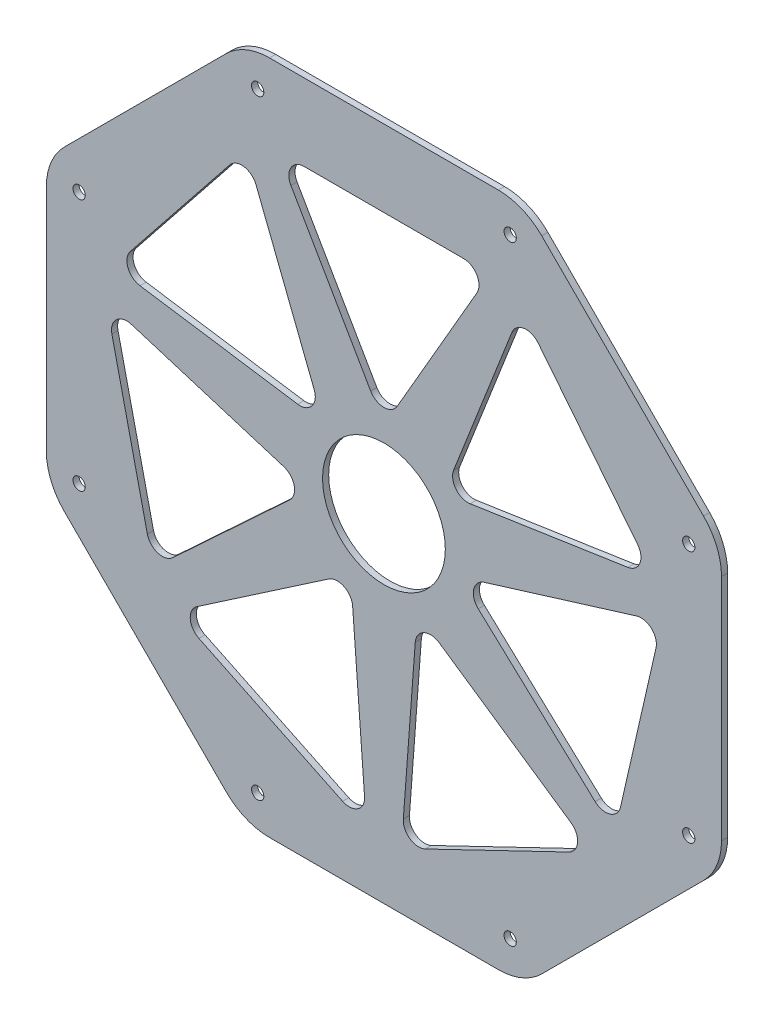
from build123d import *

# Parameters (mm, degrees)
EXTRUDE_1_DEPTH     = 2
FILLET_1_R          = 20
SKETCH_3_R          = 2
CUT_EXTRUDE_2_DEPTH = 10
SKETCH_4_R          = 20
CUT_EXTRUDE_3_DEPTH = 10
FILLET_2_R          = 5


with BuildPart() as part:
    # 草图1 → 凸台-拉伸1 (new body)
    with BuildSketch(Plane.XY):
        Polygon((110, 45.563491861), (45.563491861, 110), (-45.563491861, 110), (-110, 45.563491861), (-110, -45.563491861), (-45.563491861, -110), (45.563491861, -110), (110, -45.563491861), align=None)
    extrude(amount=EXTRUDE_1_DEPTH)

    # 圆角1
    fillet_1_edges = [part.edges().sort_by_distance(p)[0] for p in [
        (110, -45.563491861, 1),
        (45.563491861, -110, 1),
        (-45.563491861, -110, 1),
        (-110, -45.563491861, 1),
        (-110, 45.563491861, 1),
        (-45.563491861, 110, 1),
        (45.563491861, 110, 1),
        (110, 45.563491861, 1),
    ]]
    fillet(fillet_1_edges, radius=FILLET_1_R)

    # 草图3 → 切除-拉伸2 (cut)
    with BuildSketch(Plane(origin=(0, 0, 0), x_dir=(-1, 0, 0), z_dir=(0, 0, -1))):
        with Locations((-99.317049745, 41.138468979)):
            Circle(SKETCH_3_R)
        with Locations((-41.138468979, 99.317049745)):
            Circle(SKETCH_3_R)
        with Locations((41.138468979, 99.317049745)):
            Circle(SKETCH_3_R)
        with Locations((99.317049745, 41.138468979)):
            Circle(SKETCH_3_R)
        with Locations((99.317049745, -41.138468979)):
            Circle(SKETCH_3_R)
        with Locations((41.138468979, -99.317049745)):
            Circle(SKETCH_3_R)
        with Locations((-41.138468979, -99.317049745)):
            Circle(SKETCH_3_R)
        with Locations((-99.317049745, -41.138468979)):
            Circle(SKETCH_3_R)
    extrude(amount=-CUT_EXTRUDE_2_DEPTH, mode=Mode.SUBTRACT)

    # 草图4 → 切除-拉伸3 (cut)
    with BuildSketch(Plane(origin=(0, 0, 0), x_dir=(-1, 0, 0), z_dir=(0, 0, -1))):
        Circle(SKETCH_4_R)
        Polygon((88.053996306, 25.913196146), (44.857355713, 80.08007017), (19.545787062, 15.587245046), align=None)
        Polygon((0, 25), (34.641016151, 85), (-34.641016151, 85), align=None)
        Polygon((75.160521268, -52.686772939), (90.577223803, 14.858214166), (24.373197805, -5.563023349), align=None)
        Polygon((5.66964072, -91.612527386), (68.09059493, -61.552180157), (10.847093478, -22.524221698), align=None)
        Polygon((-68.09059493, -61.552180157), (-5.66964072, -91.612527386), (-10.847093478, -22.524221698), align=None)
        Polygon((-90.577223803, 14.858214166), (-75.160521268, -52.686772939), (-24.373197805, -5.563023349), align=None)
        Polygon((-44.857355713, 80.08007017), (-88.053996306, 25.913196146), (-19.545787062, 15.587245046), align=None)
    extrude(amount=-CUT_EXTRUDE_3_DEPTH, mode=Mode.SUBTRACT)

    # 圆角2
    fillet_2_edges = [part.edges().sort_by_distance(p)[0] for p in [
        (0, 25, 1),
        (34.641016151, 85, 1),
        (-34.641016151, 85, 1),
        (-5.66964072, -91.612527386, 1),
        (-10.847093478, -22.524221698, 1),
        (-68.09059493, -61.552180157, 1),
        (68.09059493, -61.552180157, 1),
        (10.847093478, -22.524221698, 1),
        (5.66964072, -91.612527386, 1),
        (90.577223803, 14.858214166, 1),
        (24.373197805, -5.563023349, 1),
        (75.160521268, -52.686772939, 1),
        (44.857355713, 80.08007017, 1),
        (19.545787062, 15.587245046, 1),
        (88.053996306, 25.913196146, 1),
        (-88.053996306, 25.913196146, 1),
        (-19.545787062, 15.587245046, 1),
        (-44.857355713, 80.08007017, 1),
        (-75.160521268, -52.686772939, 1),
        (-24.373197805, -5.563023349, 1),
        (-90.577223803, 14.858214166, 1),
    ]]
    fillet(fillet_2_edges, radius=FILLET_2_R)


solid = part.part
